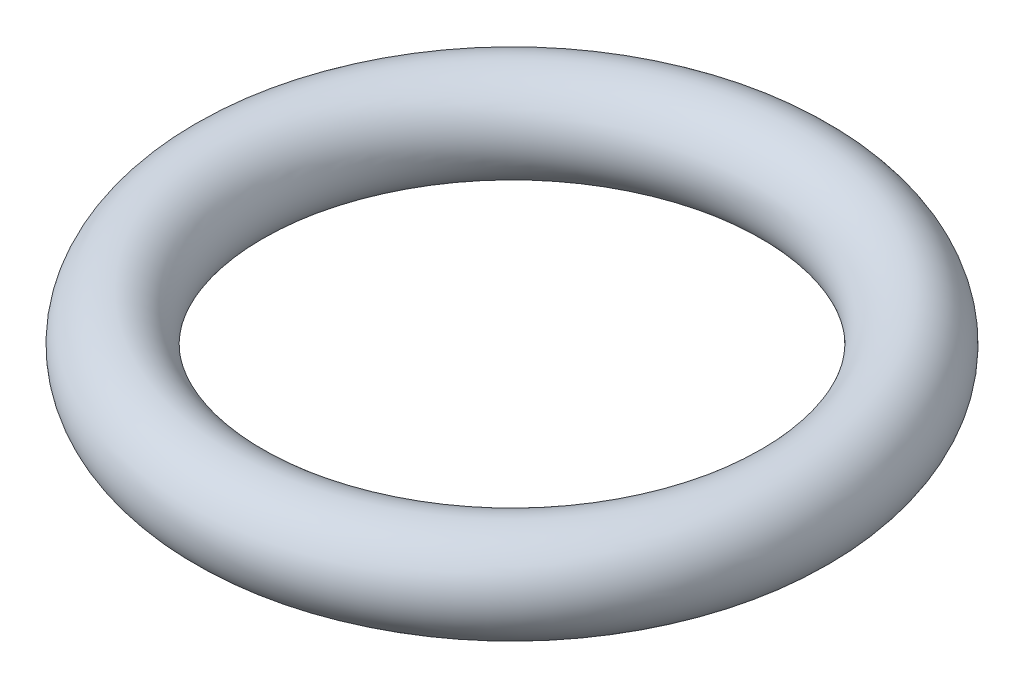
from build123d import *

# Parameters (mm, degrees)
SKETCH_1_R = 1


with BuildPart() as part:
    # 草图1 → 旋转1 (revolve)
    with BuildSketch(Plane.XY):
        with Locations((6, 0)):
            Circle(SKETCH_1_R)
    revolve(axis=Axis((0, -113.718133042, 0), (0, 1, 0)))


solid = part.part
